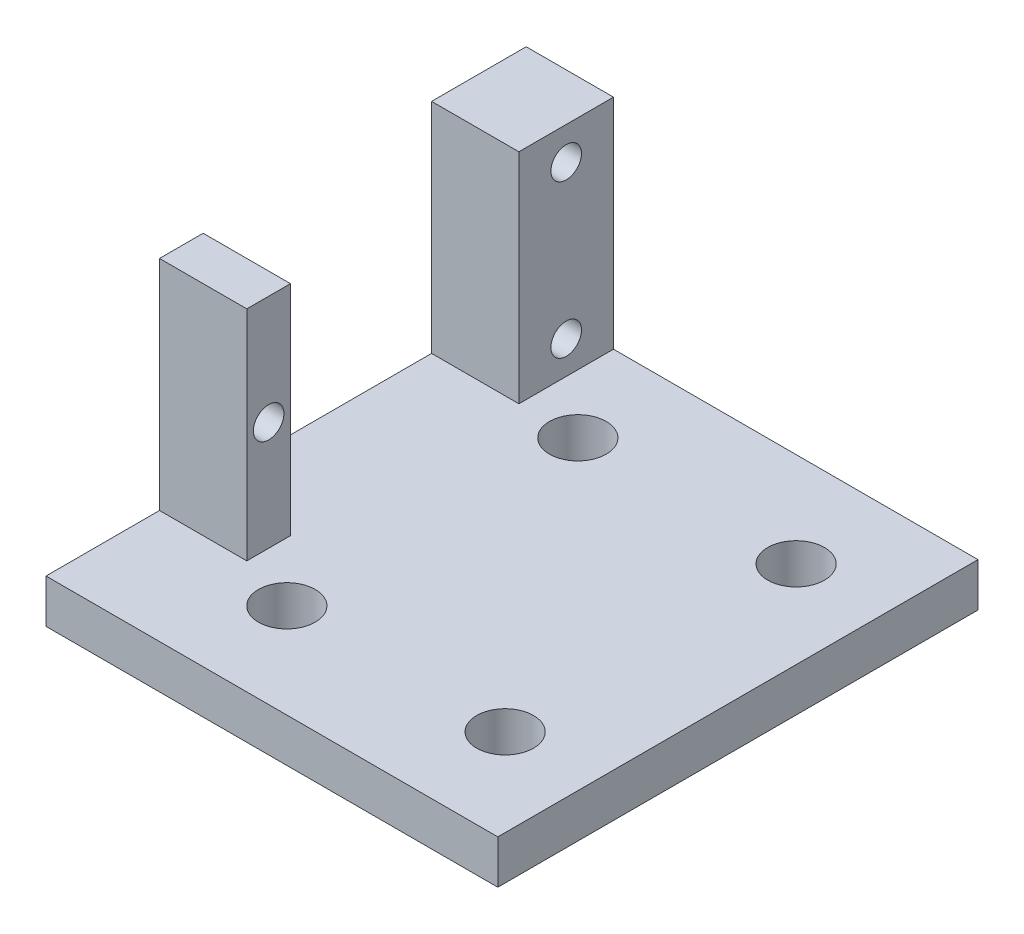
from build123d import *

# Parameters (mm, degrees)
SKETCH1_W               = 51.75
SKETCH1_H               = 55
SKETCH1_R               = 3.25
BOSS_EXTRUDE2_DEPTH     = 5
SKETCH1_6_W             = 10
SKETCH1_6_H             = 10.835
SKETCH1_6_H_2           = 5
BOSS_EXTRUDE3_DEPTH     = 30
CUT_EXTRUDE1_DEPTH      = 59.303623387
CUT_EXTRUDE1_DEPTH_BACK = 59.303623387
SKETCH4_R               = 1.75
SKETCH3_R               = 1.75
CUT_EXTRUDE2_DEPTH      = 59.303623387


with BuildPart() as part:
    # Sketch1 → Boss-Extrude2 (new body)
    with BuildSketch(Plane(origin=(0, 0, 0), x_dir=(1, 0, 0), z_dir=(0, 1, 0))):
        with Locations((2.375, 0)):
            Rectangle(SKETCH1_W, SKETCH1_H)
        with Locations((18.25, 16.665)):
            Circle(SKETCH1_R, mode=Mode.SUBTRACT)
        with Locations((-6.75, -16.665)):
            Circle(SKETCH1_R, mode=Mode.SUBTRACT)
        with Locations((18.25, -16.665)):
            Circle(SKETCH1_R, mode=Mode.SUBTRACT)
        with Locations((-6.75, 16.665)):
            Circle(SKETCH1_R, mode=Mode.SUBTRACT)
    extrude(amount=BOSS_EXTRUDE2_DEPTH)

    # Sketch1<6> → Boss-Extrude3 (add)
    with BuildSketch(Plane(origin=(0, 0, 0), x_dir=(1, 0, 0), z_dir=(0, 1, 0))):
        with Locations((-18.5, 22.0825)):
            Rectangle(SKETCH1_6_W, SKETCH1_6_H)
        with Locations((-18.5, -12)):
            Rectangle(SKETCH1_6_W, SKETCH1_6_H_2)
    extrude(amount=BOSS_EXTRUDE3_DEPTH)

    # Sketch4 → Cut-Extrude1 (cut, two sides: drawn at the far end of the back side and taken through both)
    with BuildSketch(Plane(origin=(-13.5, 0, 0), x_dir=(0, 0, -1), z_dir=(1, 0, 0)).offset(-CUT_EXTRUDE1_DEPTH_BACK)):
        with Locations((22.0825, 26.25)):
            Circle(SKETCH4_R)
        with Locations((22.0825, 8.75)):
            Circle(SKETCH4_R)
    extrude(amount=CUT_EXTRUDE1_DEPTH + CUT_EXTRUDE1_DEPTH_BACK, mode=Mode.SUBTRACT)

    # Sketch3 → Cut-Extrude2 (cut, through all)
    with BuildSketch(Plane(origin=(-13.5, 0, 0), x_dir=(0, 0, -1), z_dir=(1, 0, 0))):
        with Locations((-12, 17.5)):
            Circle(SKETCH3_R)
    extrude(amount=-CUT_EXTRUDE2_DEPTH, mode=Mode.SUBTRACT)


solid = part.part
